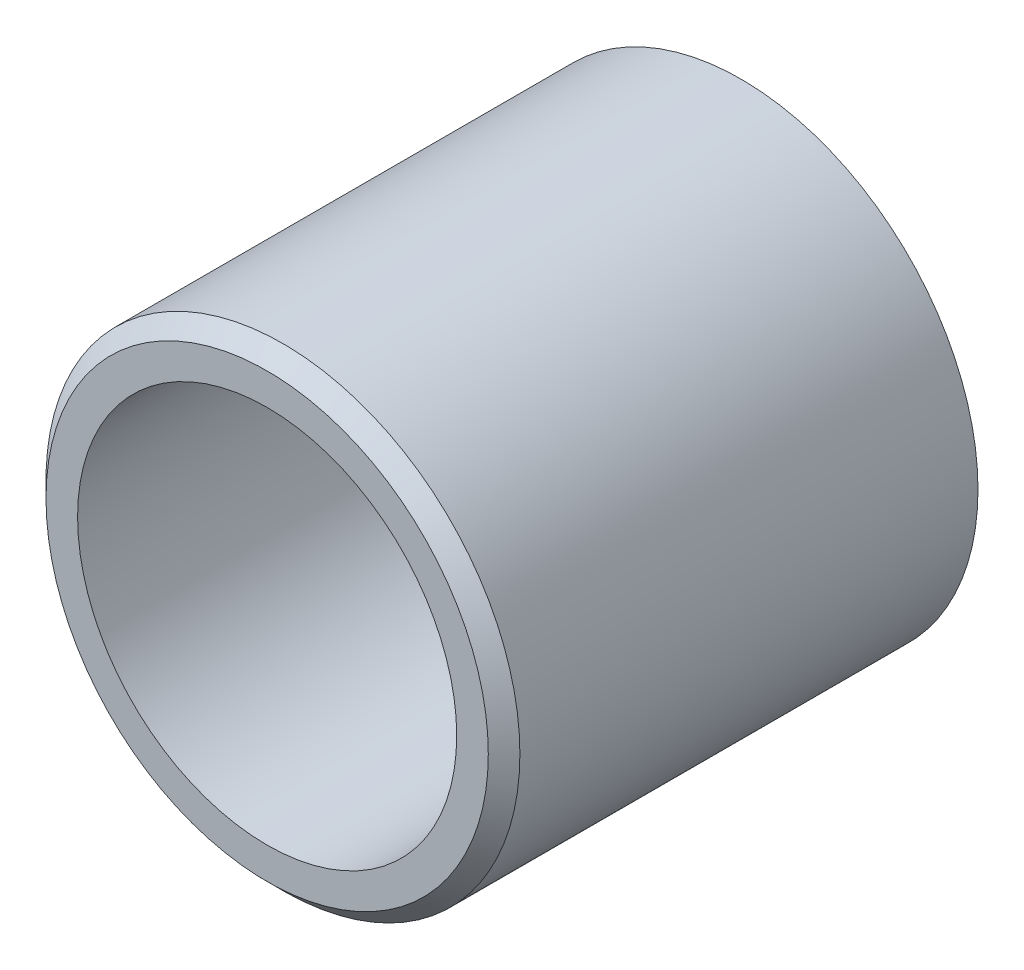
from build123d import *

# Parameters (mm, degrees)
SKETCH1_R           = 7.5
SKETCH1_R_2         = 6
BOSS_EXTRUDE1_DEPTH = 15
CHAMFER1_SIZE       = 0.5


with BuildPart() as part:
    # Sketch1 → Boss-Extrude1 (new body)
    with BuildSketch(Plane.XY):
        Circle(SKETCH1_R)
        Circle(SKETCH1_R_2, mode=Mode.SUBTRACT)
    extrude(amount=BOSS_EXTRUDE1_DEPTH)

    # Chamfer1
    chamfer1_edges = [part.edges().sort_by_distance(p)[0] for p in [
        (-7.5, 0, 15),
    ]]
    chamfer(chamfer1_edges, length=CHAMFER1_SIZE)


solid = part.part
